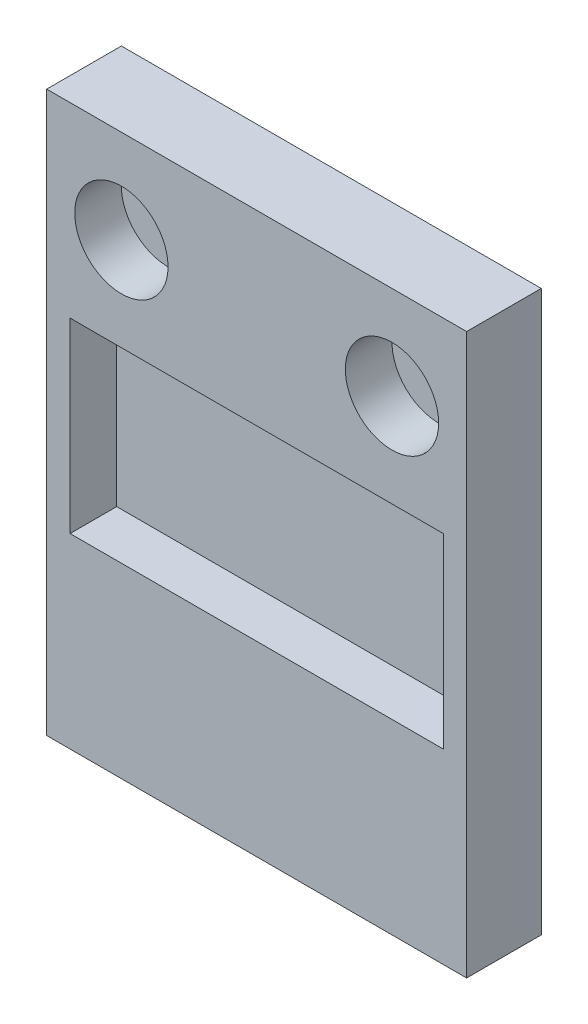
from build123d import *

# Parameters (mm, degrees)
SKETCH1_W           = 45
SKETCH1_H           = 60
BOSS_EXTRUDE1_DEPTH = 8
SKETCH2_R           = 5
SKETCH2_W           = 40
SKETCH2_H           = 20
CUT_EXTRUDE1_DEPTH  = 5


with BuildPart() as part:
    # Sketch1 → Boss-Extrude1 (new body)
    with BuildSketch(Plane.XY):
        Rectangle(SKETCH1_W, SKETCH1_H)
    extrude(amount=BOSS_EXTRUDE1_DEPTH)

    # Sketch2 → Cut-Extrude1 (cut)
    with BuildSketch(Plane.XY.offset(8)):
        with Locations((-14.5, 20)):
            Circle(SKETCH2_R)
        with Locations((14.5, 20)):
            Circle(SKETCH2_R)
        Rectangle(SKETCH2_W, SKETCH2_H)
    extrude(amount=-CUT_EXTRUDE1_DEPTH, mode=Mode.SUBTRACT)


solid = part.part
